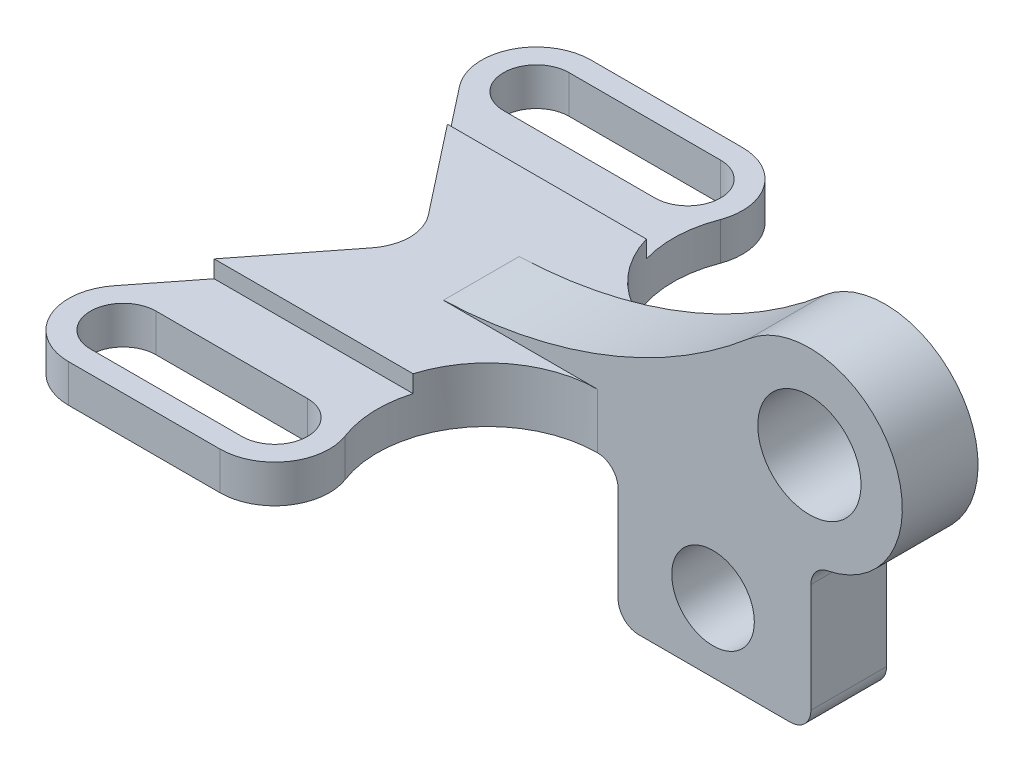
from build123d import *

# Parameters (mm, degrees)
SKETCH1_R           = 15
SKETCH1_R_2         = 12
BOSS_EXTRUDE1_DEPTH = 22
BOSS_EXTRUDE3_DEPTH = 16
SKETCH9_W           = 75.776541305
SKETCH9_H           = 5
CUT_EXTRUDE1_DEPTH  = 42
SKETCH10_W          = 75.776541305
SKETCH10_H          = 5
CUT_EXTRUDE2_DEPTH  = 42


with BuildPart() as part:
    # Sketch1 → Boss-Extrude1 (new body)
    with BuildSketch(Plane.XY):
        with BuildLine():
            Line((55.604384426, -9.406151738), (55.604384426, -41.038199431))
            ThreePointArc((55.604384426, -41.038199431), (53.847025113, -45.280840118), (49.604384426, -47.038199431))
            Line((49.604384426, -47.038199431), (5.604384426, -47.038199431))
            ThreePointArc((5.604384426, -47.038199431), (1.361743739, -45.280840118), (-0.395615574, -41.038199431))
            Line((-0.395615574, -41.038199431), (-0.395615574, -13.257389991))
            ThreePointArc((-0.395615574, -13.257389991), (-2.152974887, -9.014749304), (-6.395615574, -7.257389991))
            Line((-6.395615574, -7.257389991), (-51.162903124, -7.257389991))
            Line((-51.162903124, -7.257389991), (-51.162903124, 8.742610009))
            ThreePointArc((-51.162903124, 8.742610009), (-3.834966472, 18.603456094), (37.620760235, 43.474977893))
            ThreePointArc((37.620760235, 43.474977893), (79.465755498, 34.75331261), (60.435706944, -3.5210695))
            ThreePointArc((60.435706944, -3.5210695), (56.966924728, -5.599057366), (55.604384426, -9.406151738))
        make_face()
        with Locations((55.176658278, 22.961800569)):
            Circle(SKETCH1_R, mode=Mode.SUBTRACT)
        with Locations((27.176658278, -27.038199431)):
            Circle(SKETCH1_R_2, mode=Mode.SUBTRACT)
    extrude(amount=BOSS_EXTRUDE1_DEPTH)

    # Sketch7 → Boss-Extrude3 (add)
    with BuildSketch(Plane.XZ.offset(7.257389991)):
        with BuildLine():
            ThreePointArc((-36.240473941, -43.544887573), (-38.141585084, -58.103978296), (-51.162903124, -64.888270652))
            Line((-51.162903124, -64.888270652), (-95.162903124, -64.888270652))
            ThreePointArc((-95.162903124, -64.888270652), (-109.449332837, -55.952342799), (-107.665731017, -39.196100826))
            Line((-107.665731017, -39.196100826), (-74.842207937, 2.663454503))
            ThreePointArc((-74.842207937, 2.663454503), (-72.680751998, 6.589987728), (-71.87991075, 11))
            ThreePointArc((-71.87991075, 11), (-72.680751998, 15.410012272), (-74.842207937, 19.336545497))
            Line((-74.842207937, 19.336545497), (-107.665731017, 61.196100826))
            ThreePointArc((-107.665731017, 61.196100826), (-109.449332837, 77.952342799), (-95.162903124, 86.888270652))
            Line((-95.162903124, 86.888270652), (-51.162903124, 86.888270652))
            ThreePointArc((-51.162903124, 86.888270652), (-38.141585084, 80.103978296), (-36.240473941, 65.544887573))
            ThreePointArc((-36.240473941, 65.544887573), (-32.791035654, 35.909068602), (-6.395615574, 22))
            Line((-6.395615574, 22), (-51.162903124, 22))
            Line((-51.162903124, 22), (-51.162903124, 0))
            Line((-51.162903124, 0), (-6.395615574, 0))
            ThreePointArc((-6.395615574, 0), (-32.791035654, -13.909068602), (-36.240473941, -43.544887573))
        make_face()
        with BuildLine():
            ThreePointArc((-51.162903124, -58.536156571), (-41.626746553, -49), (-51.162903124, -39.463843429))
            Line((-51.162903124, -39.463843429), (-95.162903124, -39.463843429))
            ThreePointArc((-95.162903124, -39.463843429), (-104.699059695, -49), (-95.162903124, -58.536156571))
            Line((-95.162903124, -58.536156571), (-51.162903124, -58.536156571))
        make_face(mode=Mode.SUBTRACT)
        with BuildLine():
            ThreePointArc((-95.162903124, 80.536156571), (-104.699059695, 71), (-95.162903124, 61.463843429))
            Line((-95.162903124, 61.463843429), (-51.162903124, 61.463843429))
            ThreePointArc((-51.162903124, 61.463843429), (-41.626746553, 71), (-51.162903124, 80.536156571))
            Line((-51.162903124, 80.536156571), (-95.162903124, 80.536156571))
        make_face(mode=Mode.SUBTRACT)
    extrude(amount=-BOSS_EXTRUDE3_DEPTH)

    # Sketch9 → Cut-Extrude1 (cut)
    with BuildSketch(Plane.XY.offset(86.888270652)):
        with Locations((-73.162903125, 6.242610009)):
            Rectangle(SKETCH9_W, SKETCH9_H)
    extrude(amount=-CUT_EXTRUDE1_DEPTH, mode=Mode.SUBTRACT)

    # Sketch10 → Cut-Extrude2 (cut)
    with BuildSketch(Plane(origin=(0, 0, -64.888270652), x_dir=(-1, 0, 0), z_dir=(0, 0, -1))):
        with Locations((73.162903125, 6.242610009)):
            Rectangle(SKETCH10_W, SKETCH10_H)
    extrude(amount=-CUT_EXTRUDE2_DEPTH, mode=Mode.SUBTRACT)


solid = part.part
